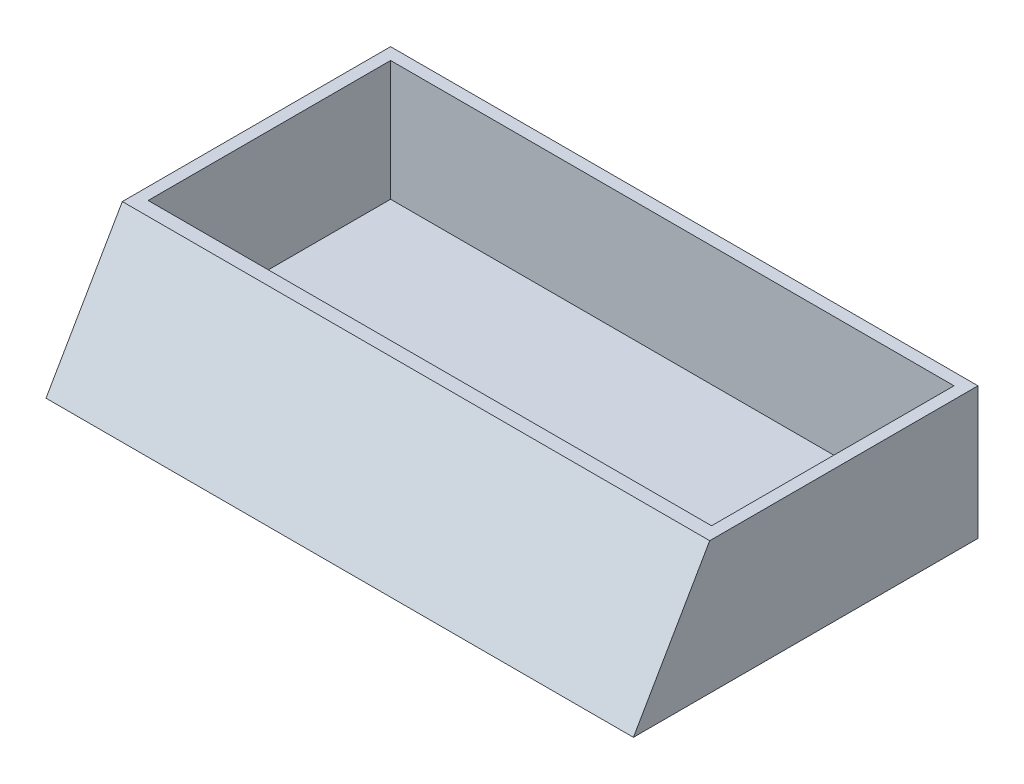
from build123d import *

# Parameters (mm, degrees)
SALIENTE_EXTRUIR1_DEPTH = 196
VACIADO1_T              = -4


with BuildPart() as part:
    # Croquis1 → Saliente-Extruir1 (new body)
    with BuildSketch(Plane(origin=(0, 0, 0), x_dir=(0, 0, -1), z_dir=(1, 0, 0))):
        Polygon((0, 0), (114.98, 0), (114.98, 44.1), (25.461146871, 44.1), align=None)
    extrude(amount=SALIENTE_EXTRUIR1_DEPTH)

    # Vaciado1
    vaciado1_openings = [part.faces().sort_by_distance(p)[0] for p in [
        (98, 44.1, -70.220573436),
    ]]
    offset(amount=VACIADO1_T, openings=vaciado1_openings, kind=Kind.INTERSECTION)


solid = part.part
